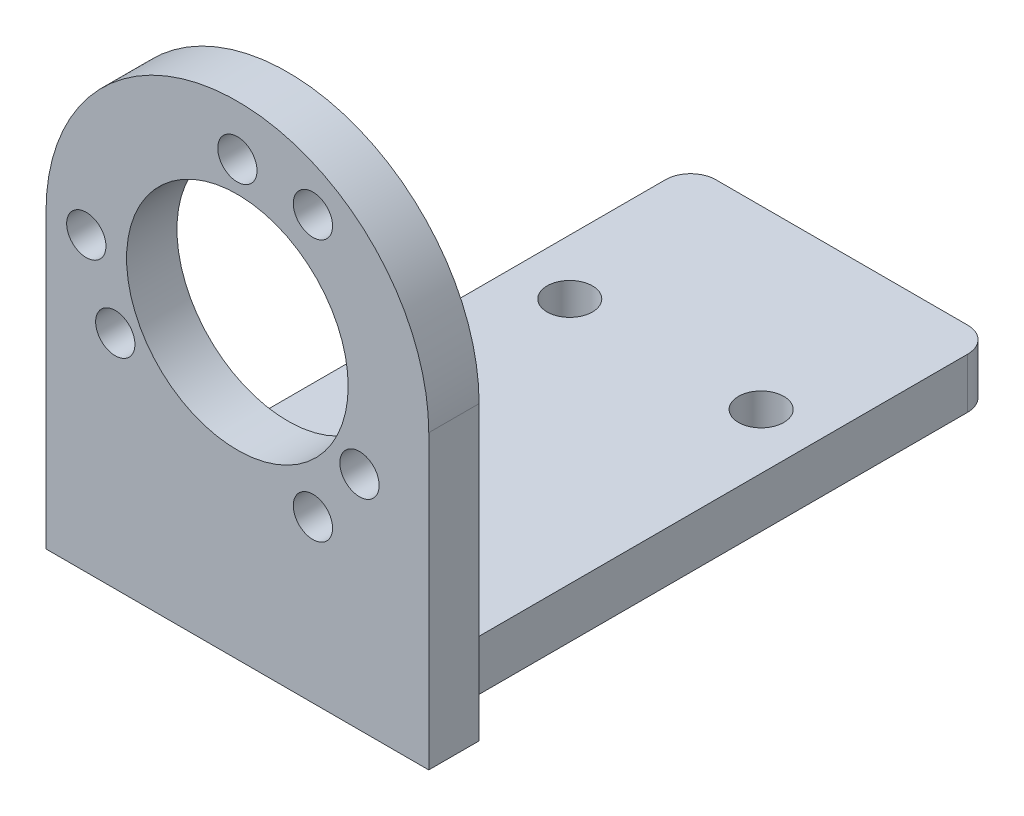
from build123d import *

# Parameters (mm, degrees)
SKETCH1_R            = 19
SKETCH1_R_2          = 11
BOSS_EXTRUDE1_DEPTH  = 5
SKETCH2_W            = 30
SKETCH2_H            = 5
BOSS_EXTRUDE2_DEPTH  = 55
M3_CLEARANCE_HOLE1_D = 3.9
M4_CLEARANCE_HOLE1_D = 4.5
FILLET1_R            = 2.5


with BuildPart() as part:
    # Sketch1 → Boss-Extrude1 (new body)
    # profile 1 of 2: a face of its own
    with BuildSketch(Plane.XY):
        Circle(SKETCH1_R)
        Circle(SKETCH1_R_2, mode=Mode.SUBTRACT)
    # profile 2 of 2: a face of its own
    with BuildSketch(Plane.XY):
        with BuildLine():
            ThreePointArc((19, 0), (0, -19), (-19, 0))
            Line((-19, 0), (-19, -29))
            Line((-19, -29), (19, -29))
            Line((19, -29), (19, 0))
        make_face()
    extrude(amount=BOSS_EXTRUDE1_DEPTH)

    # Sketch2 → Boss-Extrude2 (add)
    with BuildSketch(Plane(origin=(0, 0, 0), x_dir=(-1, 0, 0), z_dir=(0, 0, -1))):
        with Locations((0, -26.5)):
            Rectangle(SKETCH2_W, SKETCH2_H)
    extrude(amount=BOSS_EXTRUDE2_DEPTH)

    # M3 Clearance Hole1 (through all)
    with Locations(Plane.XY.offset(5)):
        with Locations((-15, 0), (0, 14), (12.124355653, -7), (-12.124355653, -7), (7.5, 12.990381057), (7.5, -12.990381057)):
            Hole(M3_CLEARANCE_HOLE1_D / 2)

    # M4 Clearance Hole1 (through all)
    with Locations(Plane(origin=(0, -24, 0), x_dir=(1, 0, 0), z_dir=(0, 1, 0))):
        with Locations((-9.5, 37.5), (9.5, 37.5)):
            Hole(M4_CLEARANCE_HOLE1_D / 2)

    # Fillet1
    fillet1_edges = [part.edges().sort_by_distance(p)[0] for p in [
        (15, -26.5, 0),
        (-15, -26.5, 0),
        (0, -24, 0),
        (15, -26.5, -55),
        (-15, -26.5, -55),
    ]]
    fillet(fillet1_edges, radius=FILLET1_R)


solid = part.part
